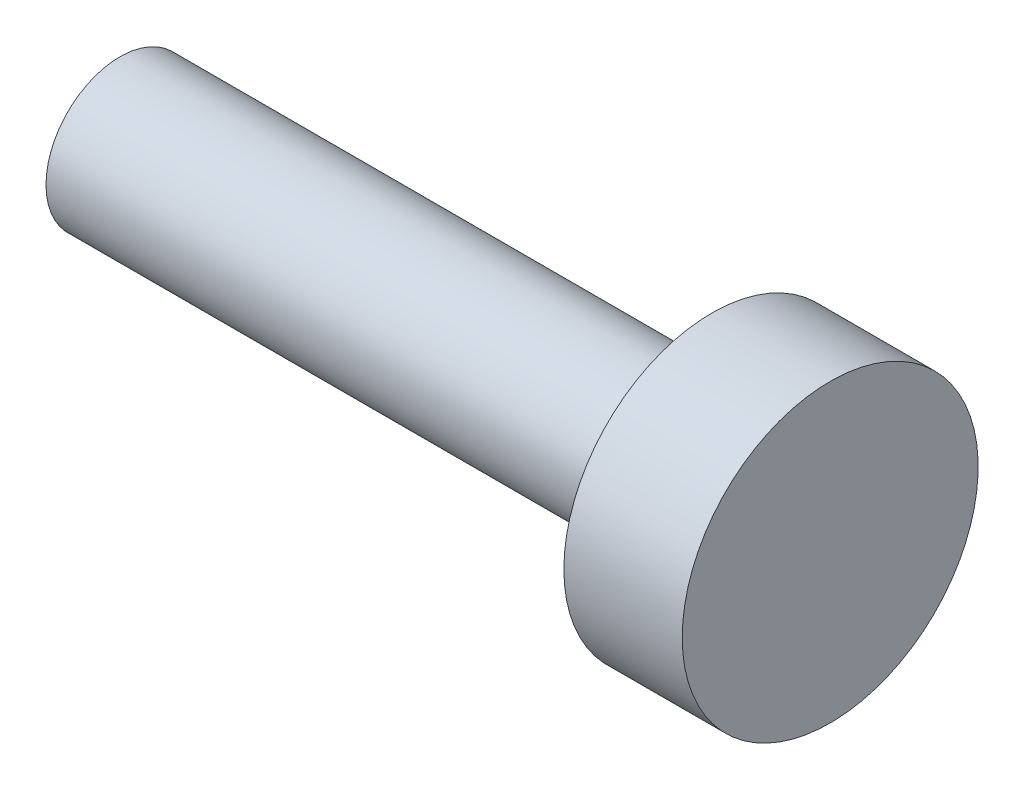
from build123d import *


with BuildPart() as part:
    # Skica1 → Rotovat3 (revolve)
    with BuildSketch(Plane.XY, mode=Mode.PRIVATE) as rotovat3_sk:
        Polygon((12, 2.5), (10, 2.5), (10, 1.25), (0, 1.25), (0, 0), (12, 0), align=None)
    revolve(rotovat3_sk.sketch.rotate(Axis((0, 0, 0), (1, 0, 0)), 90), axis=Axis((0, 0, 0), (1, 0, 0)))


solid = part.part
